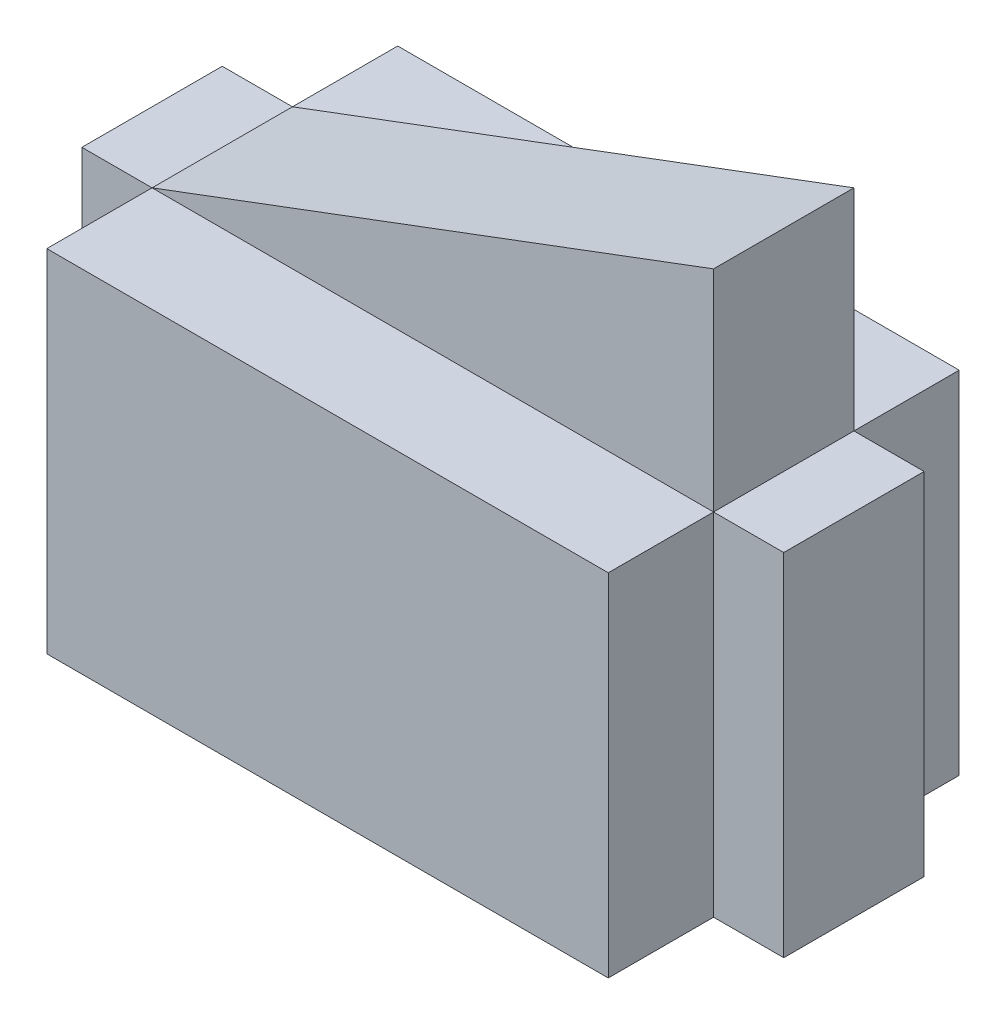
from build123d import *

# Parameters (mm, degrees)
SKETCH_1_W          = 8
SKETCH_1_H          = 5
EXTRUDE_1_DEPTH     = 5
SKETCH_2_W          = 1
SKETCH_2_H          = 2
EXTRUDE_2_DEPTH     = 5
EXTRUDE_3_DEPTH     = 1
SKETCH_7_W          = 8
SKETCH_7_H          = 1.5
EXTRUDE_4_DEPTH     = 1
CUT_EXTRUDE_2_DEPTH = 11.677078252
CUT_EXTRUDE_3_DEPTH = 10
CUT_EXTRUDE_4_DEPTH = 10
SKETCH_11_R         = 1.25
CUT_EXTRUDE_5_DEPTH = 1


with BuildPart() as part:
    # 草图1 → 凸台-拉伸1 (new body)
    with BuildSketch(Plane.XY):
        with Locations((0, 2.5)):
            Rectangle(SKETCH_1_W, SKETCH_1_H)
    extrude(amount=EXTRUDE_1_DEPTH)

    # 草图2 → 凸台-拉伸2 (add)
    with BuildSketch(Plane(origin=(0, 5, 0), x_dir=(1, 0, 0), z_dir=(0, 1, 0))):
        with Locations((-4.5, -2.5)):
            Rectangle(SKETCH_2_W, SKETCH_2_H)
        with Locations((4.5, -2.5)):
            Rectangle(SKETCH_2_W, SKETCH_2_H)
    extrude(amount=-EXTRUDE_2_DEPTH)

    # 草图6 → 凸台-拉伸3 (add, symmetric)
    with BuildSketch(Plane.XY.offset(2.5)):
        Polygon((4, 5), (4, 8), (-4, 5), align=None)
    extrude(amount=EXTRUDE_3_DEPTH, both=True)

    # 草图7 → 凸台-拉伸4 (add)
    with BuildSketch(Plane(origin=(0, 5, 0), x_dir=(1, 0, 0), z_dir=(0, 1, 0))):
        with Locations((0, -0.75)):
            Rectangle(SKETCH_7_W, SKETCH_7_H)
        with Locations((0, -4.25)):
            Rectangle(SKETCH_7_W, SKETCH_7_H)
    extrude(amount=EXTRUDE_4_DEPTH)

    # 草图8 → 切除-拉伸2 (cut, through all)
    with BuildSketch(Plane.XY.offset(5)):
        Polygon((-4, 5), (4, 8), (-4.143186706, 8), (-4.143186706, 5), align=None)
    extrude(amount=-CUT_EXTRUDE_2_DEPTH, mode=Mode.SUBTRACT)

    # 草图9 → 切除-拉伸3 (cut)
    with BuildSketch(Plane(origin=(0, 0, 1.5), x_dir=(-1, 0, 0), z_dir=(0, 0, -1))):
        Polygon((-4, 8), (-4, 5), (4, 5), align=None)
    extrude(amount=CUT_EXTRUDE_3_DEPTH, mode=Mode.SUBTRACT)

    # 草图10 → 切除-拉伸4 (cut)
    with BuildSketch(Plane.XY.offset(3.5)):
        Polygon((4, 8), (4, 5), (-4, 5), align=None)
    extrude(amount=CUT_EXTRUDE_4_DEPTH, mode=Mode.SUBTRACT)

    # 草图11 → 切除-拉伸5 (cut)
    with BuildSketch(Plane.XZ):
        with Locations(Location((0, 2.5, 0), (0, 0, 270))):
            Circle(SKETCH_11_R)
    extrude(amount=-CUT_EXTRUDE_5_DEPTH, mode=Mode.SUBTRACT)


solid = part.part
